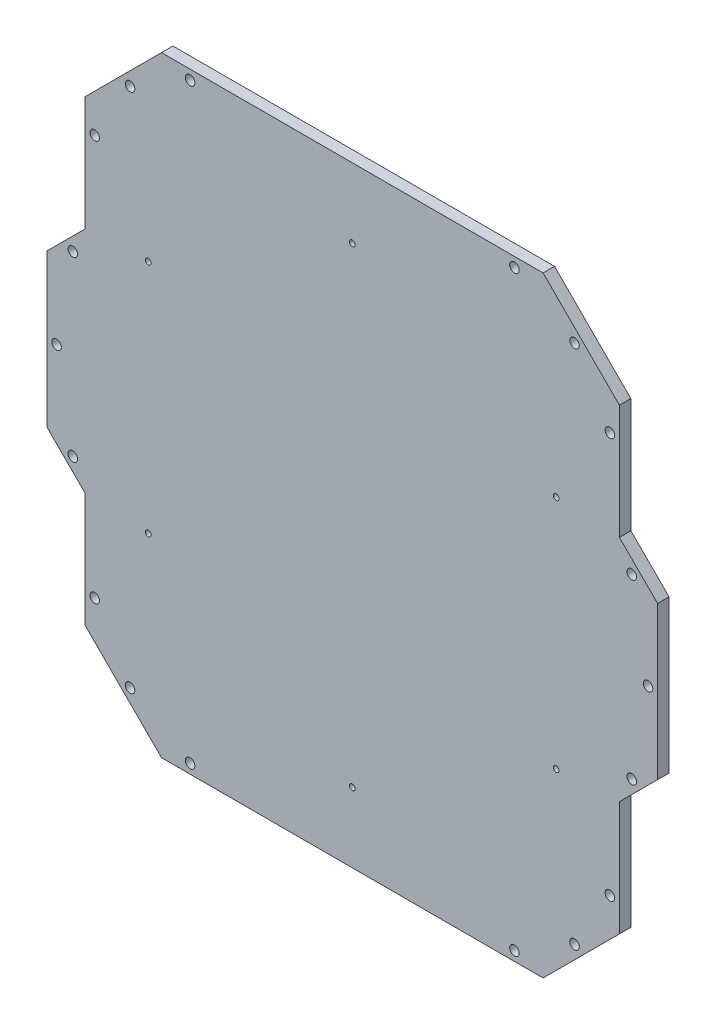
from build123d import *

# Parameters (mm, degrees)
MODEL_R             = 1.25
BOSS_EXTRUDE1_DEPTH = 3
SKETCH1_R           = 0.75
CUT_EXTRUDE1_DEPTH  = 10


with BuildPart() as part:
    # Model → Boss-Extrude1 (new body)
    with BuildSketch(Plane.XY):
        Polygon((41.057603072, 7.198758191), (141.057603072, 7.198758191), (161.057603072, 27.198758191), (161.057603072, 57.198758191), (171.057603072, 67.198758191), (171.057603072, 107.198758191), (161.057603072, 117.198758191), (161.057603072, 147.198758191), (141.057603072, 167.198758191), (41.057603072, 167.198758191), (21.057603072, 147.198758191), (21.057603072, 117.198758191), (11.057603072, 107.198758191), (11.057603072, 67.198758191), (21.057603072, 57.198758191), (21.057603072, 27.198758191), align=None)
        with Locations((133.557603072, 9.698758191)):
            Circle(MODEL_R, mode=Mode.SUBTRACT)
        with Locations((158.557603072, 34.698758191)):
            Circle(MODEL_R, mode=Mode.SUBTRACT)
        with Locations((149.289836119, 18.966525144)):
            Circle(MODEL_R, mode=Mode.SUBTRACT)
        with Locations((48.557603072, 9.698758191)):
            Circle(MODEL_R, mode=Mode.SUBTRACT)
        with Locations((23.557603072, 34.698758191)):
            Circle(MODEL_R, mode=Mode.SUBTRACT)
        with Locations((32.825370025, 18.966525144)):
            Circle(MODEL_R, mode=Mode.SUBTRACT)
        with Locations((133.557603072, 164.698758191)):
            Circle(MODEL_R, mode=Mode.SUBTRACT)
        with Locations((158.557603072, 139.698758191)):
            Circle(MODEL_R, mode=Mode.SUBTRACT)
        with Locations((149.289836119, 155.430991238)):
            Circle(MODEL_R, mode=Mode.SUBTRACT)
        with Locations((48.557603072, 164.698758191)):
            Circle(MODEL_R, mode=Mode.SUBTRACT)
        with Locations((23.557603072, 139.698758191)):
            Circle(MODEL_R, mode=Mode.SUBTRACT)
        with Locations((32.825370025, 155.430991238)):
            Circle(MODEL_R, mode=Mode.SUBTRACT)
        with Locations((17.825370025, 63.966525144)):
            Circle(MODEL_R, mode=Mode.SUBTRACT)
        with Locations((13.557603072, 87.198758191)):
            Circle(MODEL_R, mode=Mode.SUBTRACT)
        with Locations((17.825370025, 110.430991238)):
            Circle(MODEL_R, mode=Mode.SUBTRACT)
        with Locations((164.289836119, 63.966525144)):
            Circle(MODEL_R, mode=Mode.SUBTRACT)
        with Locations((168.557603072, 87.198758191)):
            Circle(MODEL_R, mode=Mode.SUBTRACT)
        with Locations((164.289836119, 110.430991238)):
            Circle(MODEL_R, mode=Mode.SUBTRACT)
    extrude(amount=BOSS_EXTRUDE1_DEPTH)

    # Sketch1 → Cut-Extrude1 (cut)
    with BuildSketch(Plane.XY.offset(3)):
        with Locations((91.057603072, 148.911555292)):
            Circle(SKETCH1_R)
        with Locations((37.612753044, 118.055156741)):
            Circle(SKETCH1_R)
        with Locations((144.502453099, 118.055156741)):
            Circle(SKETCH1_R)
        with Locations(Location((144.502453099, 56.342359641, 0), (0, 0, 180))):
            Circle(SKETCH1_R)
        with Locations(Location((91.057603072, 25.485961091, 0), (0, 0, 180))):
            Circle(SKETCH1_R)
        with Locations(Location((37.612753044, 56.342359641, 0), (0, 0, 180))):
            Circle(SKETCH1_R)
    extrude(amount=-CUT_EXTRUDE1_DEPTH, mode=Mode.SUBTRACT)


solid = part.part
